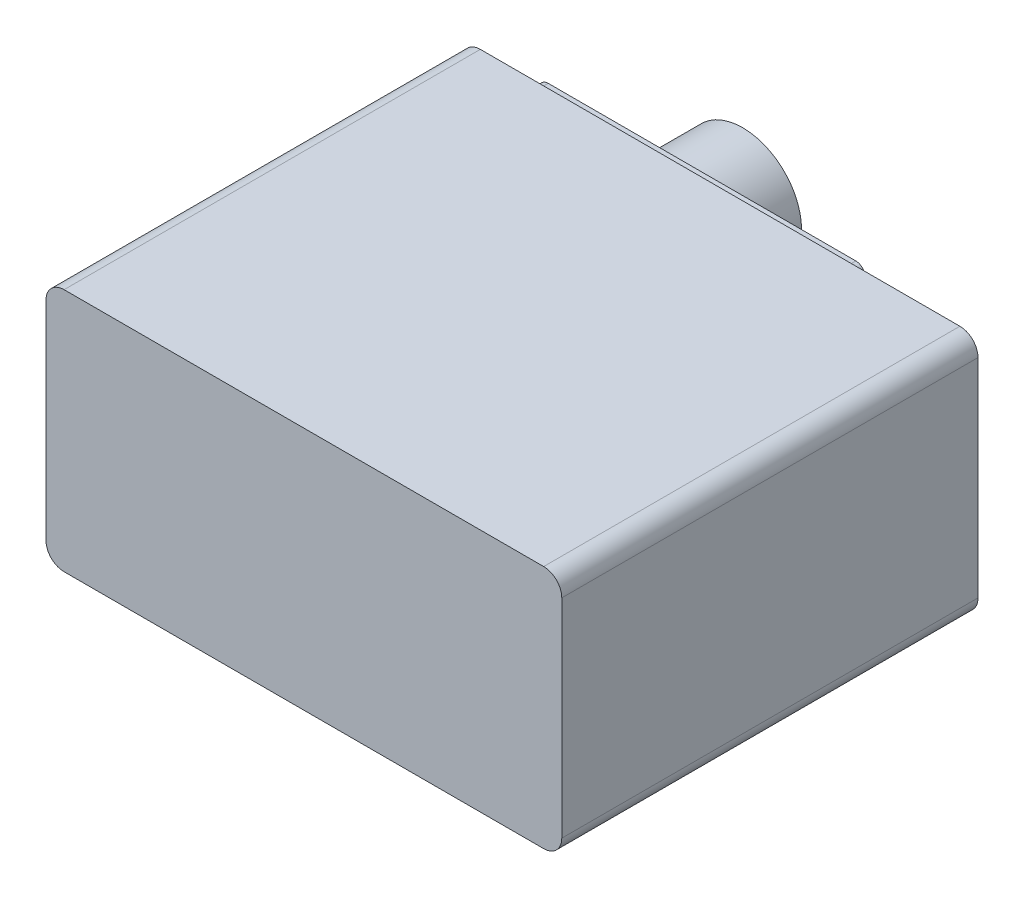
from build123d import *

# Parameters (mm, degrees)
BOSS_EXTRU_1_DEPTH      = 46
CONG_1_R                = 2
ESQUISSE2_W             = 36
ESQUISSE2_H             = 20
BOSS_EXTRU_2_DEPTH      = 4
CONG_3_R                = 1
ESQUISSE4_R             = 6.5
BOSS_EXTRU_3_DEPTH      = 10
ESQUISSE5_R             = 5
ESQUISSE5_R_2           = 3
ENL_V_MAT_EXTRU_1_DEPTH = 2
BOSS_EXTRU_4_DEPTH      = 4


with BuildPart() as part:
    # Esquisse1 → Boss.-Extru.1 (new body)
    with BuildSketch(Plane.XY):
        Polygon((0, -13.5), (28.5, -13.5), (28.5, 13.5), (-28.5, 13.5), (-28.5, -13.5), align=None)
    extrude(amount=BOSS_EXTRU_1_DEPTH)

    # Congé1
    cong_1_edges = [part.edges().sort_by_distance(p)[0] for p in [
        (-28.5, -13.5, 23),
        (-28.5, 13.5, 23),
        (28.5, 13.5, 23),
        (28.5, -13.5, 23),
    ]]
    fillet(cong_1_edges, radius=CONG_1_R)

    # Esquisse2 → Boss.-Extru.2 (add)
    with BuildSketch(Plane(origin=(0, 0, 0), x_dir=(-1, 0, 0), z_dir=(0, 0, -1))):
        with Locations((6, 0)):
            Rectangle(ESQUISSE2_W, ESQUISSE2_H)
    extrude(amount=BOSS_EXTRU_2_DEPTH)

    # Congé3
    cong_3_edges = [part.edges().sort_by_distance(p)[0] for p in [
        (-24, 10, -2),
        (12, 10, -2),
        (12, -10, -2),
        (-24, -10, -2),
    ]]
    fillet(cong_3_edges, radius=CONG_3_R)

    # Esquisse4 → Boss.-Extru.3 (add)
    with BuildSketch(Plane(origin=(0, 0, -4), x_dir=(-1, 0, 0), z_dir=(0, 0, -1))):
        with Locations(Location((11.5, 0, 0), (0, 0, 180))):
            Circle(ESQUISSE4_R)
    extrude(amount=BOSS_EXTRU_3_DEPTH)

    # Esquisse5 → Enlèv. mat.-Extru.1 (cut)
    with BuildSketch(Plane(origin=(0, 0, -14), x_dir=(-1, 0, 0), z_dir=(0, 0, -1))):
        with Locations((11.5, 0)):
            Circle(ESQUISSE5_R)
        with Locations((11.5, 0)):
            Circle(ESQUISSE5_R_2, mode=Mode.SUBTRACT)
    extrude(amount=-ENL_V_MAT_EXTRU_1_DEPTH, mode=Mode.SUBTRACT)

    # Esquisse7 → Boss.-Extru.4 (add)
    with BuildSketch(Plane(origin=(0, 0, 0), x_dir=(-1, 0, 0), z_dir=(0, 0, -1))):
        with BuildLine():
            Line((-12, -5), (-12, 0))
            Line((-12, 0), (-12, 5))
            ThreePointArc((-12, 5), (-17, 0), (-12, -5))
        make_face()
    extrude(amount=BOSS_EXTRU_4_DEPTH)


solid = part.part
